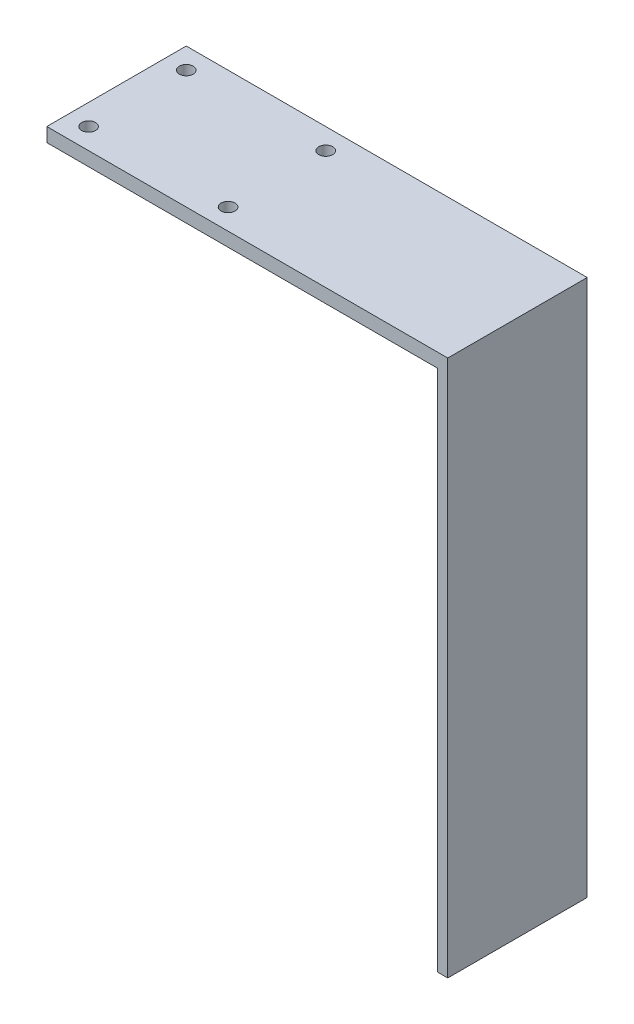
from build123d import *

# Parameters (mm, degrees)
SKETCH1_W           = 115
SKETCH1_H           = 40
SKETCH1_R           = 2
BOSS_EXTRUDE1_DEPTH = 4
SKETCH3_W           = 3
SKETCH3_H           = 40
BOSS_EXTRUDE3_DEPTH = 150


with BuildPart() as part:
    # Sketch1 → Boss-Extrude1 (new body)
    with BuildSketch(Plane(origin=(0, 0, 0), x_dir=(1, 0, 0), z_dir=(0, 1, 0))):
        Rectangle(SKETCH1_W, SKETCH1_H)
        with Locations(Location((-11.5, 14, 0), (0, 0, 270))):
            Circle(SKETCH1_R, mode=Mode.SUBTRACT)
        with Locations(Location((-11.5, -14, 0), (0, 0, 270))):
            Circle(SKETCH1_R, mode=Mode.SUBTRACT)
        with Locations(Location((-51.5, -14, 0), (0, 0, 270))):
            Circle(SKETCH1_R, mode=Mode.SUBTRACT)
        with Locations(Location((-51.5, 14, 0), (0, 0, 270))):
            Circle(SKETCH1_R, mode=Mode.SUBTRACT)
    extrude(amount=BOSS_EXTRUDE1_DEPTH)

    # Sketch3 → Boss-Extrude3 (add)
    with BuildSketch(Plane.XZ):
        with Locations((56, 0)):
            Rectangle(SKETCH3_W, SKETCH3_H)
    extrude(amount=BOSS_EXTRUDE3_DEPTH)


solid = part.part
